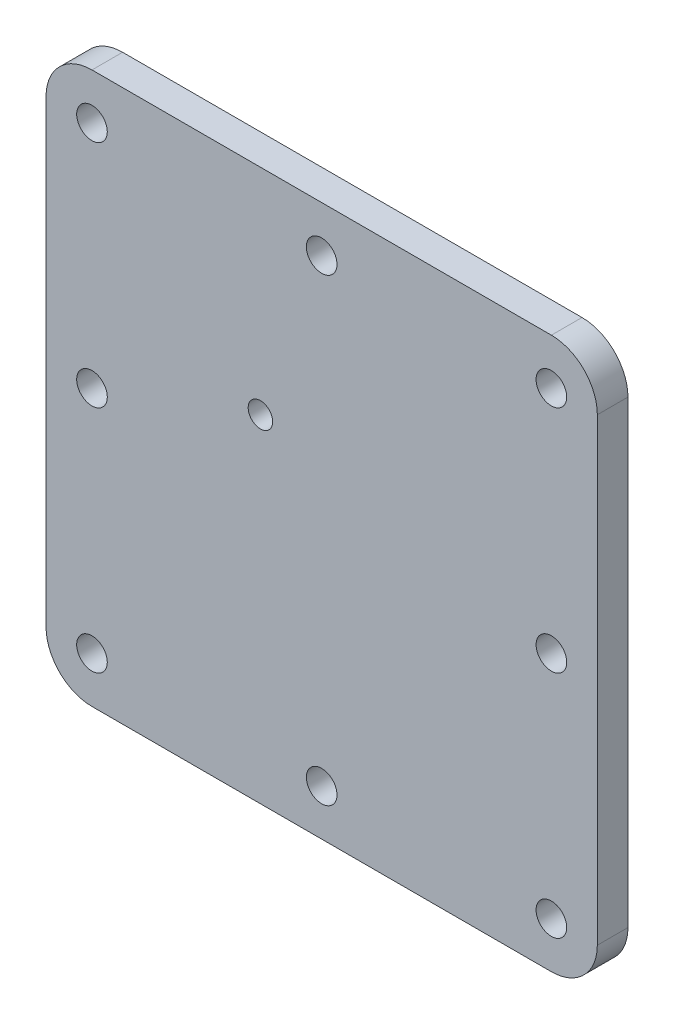
from build123d import *

# Parameters (mm, degrees)
SKETCH2_R           = 5
BOSS_EXTRUDE1_DEPTH = 10
SKETCH5_R           = 4
CUT_EXTRUDE5_DEPTH  = 10


with BuildPart() as part:
    # Sketch2 → Boss-Extrude1 (new body)
    with BuildSketch(Plane.XY):
        with BuildLine():
            Line((-75, 90), (75, 90))
            ThreePointArc((75, 90), (85.606601718, 85.606601718), (90, 75))
            Line((90, 75), (90, -75))
            ThreePointArc((90, -75), (85.606601718, -85.606601718), (75, -90))
            Line((75, -90), (-75, -90))
            ThreePointArc((-75, -90), (-85.606601718, -85.606601718), (-90, -75))
            Line((-90, -75), (-90, 75))
            ThreePointArc((-90, 75), (-85.606601718, 85.606601718), (-75, 90))
        make_face()
        with Locations((-75, 75)):
            Circle(SKETCH2_R, mode=Mode.SUBTRACT)
        with Locations((0, 75)):
            Circle(SKETCH2_R, mode=Mode.SUBTRACT)
        with Locations((75, 75)):
            Circle(SKETCH2_R, mode=Mode.SUBTRACT)
        with Locations((-75, 0)):
            Circle(SKETCH2_R, mode=Mode.SUBTRACT)
        with Locations((75, 0)):
            Circle(SKETCH2_R, mode=Mode.SUBTRACT)
        with Locations((-75, -75)):
            Circle(SKETCH2_R, mode=Mode.SUBTRACT)
        with Locations((0, -75)):
            Circle(SKETCH2_R, mode=Mode.SUBTRACT)
        with Locations((75, -75)):
            Circle(SKETCH2_R, mode=Mode.SUBTRACT)
    extrude(amount=BOSS_EXTRUDE1_DEPTH)

    # Sketch5 → Cut-Extrude5 (cut)
    with BuildSketch(Plane.XY.offset(10)):
        with Locations((-20, 20)):
            Circle(SKETCH5_R)
    extrude(amount=-CUT_EXTRUDE5_DEPTH, mode=Mode.SUBTRACT)


solid = part.part
